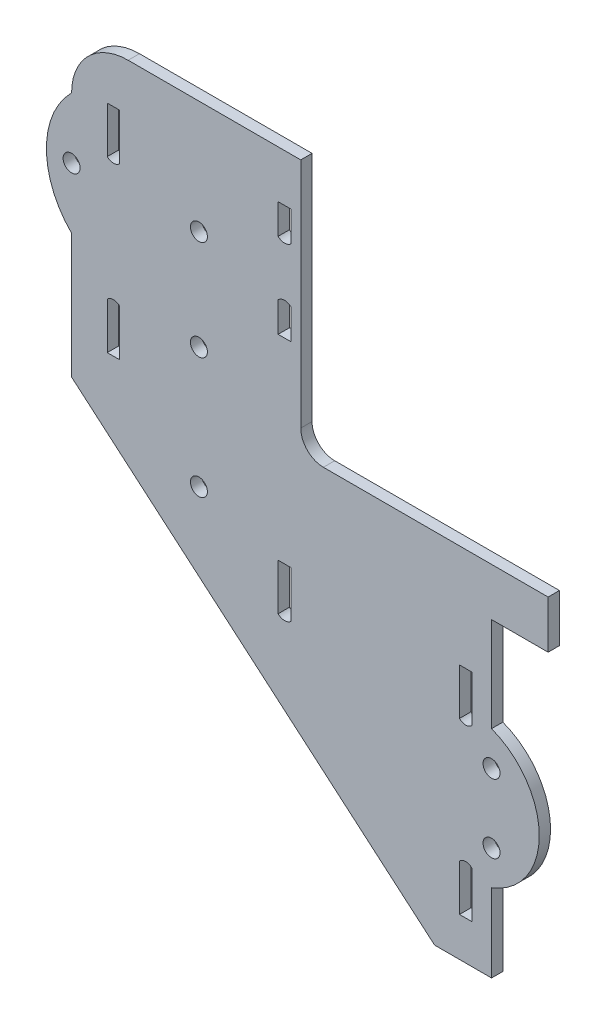
from build123d import *

# Parameters (mm, degrees)
SKETCH_1_R      = 1.5
EXTRUDE_1_DEPTH = 2


with BuildPart() as part:
    # 草图1 → 凸台-拉伸1 (new body)
    with BuildSketch(Plane.XY):
        with BuildLine():
            Line((24.667061038, -23.701524127), (24.667061038, 17.348475873))
            Line((24.667061038, 17.348475873), (-5.837728854, 17.348475873))
            ThreePointArc((-5.837728854, 17.348475873), (-12.908796666, 14.419543685), (-15.837728854, 7.348475873))
            ThreePointArc((-15.837728854, 7.348475873), (-20.286537867, -3.391899182), (-15.837728854, -14.132274238))
            Line((-15.837728854, -14.132274238), (-15.837728854, -36.151614729))
            Line((-15.837728854, -36.151614729), (48.322917805, -91.01542846))
            Line((48.322917805, -91.01542846), (58.385554114, -91.01542846))
            Line((58.385554114, -91.01542846), (58.385554114, -77.195903488))
            ThreePointArc((58.385554114, -77.195903488), (66.817061038, -65.025083014), (58.385554114, -52.85426254))
            Line((58.385554114, -52.85426254), (58.385554114, -41.837165292))
            Line((58.385554114, -41.837165292), (58.385554114, -36.151614729))
            Line((58.385554114, -36.151614729), (68.385554114, -36.151614729))
            Line((68.385554114, -36.151614729), (68.385554114, -27.701524127))
            Line((68.385554114, -27.701524127), (58.385554114, -27.701524127))
            Line((58.385554114, -27.701524127), (28.667061038, -27.701524127))
            ThreePointArc((28.667061038, -27.701524127), (25.838633913, -26.529951252), (24.667061038, -23.701524127))
        make_face()
        with Locations((6.667061038, -41.688027493)):
            Circle(SKETCH_1_R, mode=Mode.SUBTRACT)
        with BuildLine():
            Line((20.667061038, -54.125083014), (20.667061038, -45.925083014))
            Line((20.667061038, -45.925083014), (22.967061038, -45.925083014))
            Line((22.967061038, -45.925083014), (22.967061038, -54.125083014))
            ThreePointArc((22.967061038, -54.125083014), (21.817061038, -54.601428611), (20.667061038, -54.125083014))
        make_face(mode=Mode.SUBTRACT)
        with BuildLine():
            Line((52.717061038, -84.125083014), (52.717061038, -75.925083014))
            ThreePointArc((52.717061038, -75.925083014), (53.817061038, -75.469448095), (54.917061038, -75.925083014))
            Line((54.917061038, -75.925083014), (54.917061038, -84.125083014))
            Line((54.917061038, -84.125083014), (52.717061038, -84.125083014))
        make_face(mode=Mode.SUBTRACT)
        with Locations((58.385554114, -71.110493251)):
            Circle(SKETCH_1_R, mode=Mode.SUBTRACT)
        with Locations((58.385554114, -58.939672777)):
            Circle(SKETCH_1_R, mode=Mode.SUBTRACT)
        with BuildLine():
            Line((52.717061038, -54.125083014), (52.717061038, -45.925083014))
            Line((52.717061038, -45.925083014), (54.917061038, -45.925083014))
            Line((54.917061038, -45.925083014), (54.917061038, -54.125083014))
            ThreePointArc((54.917061038, -54.125083014), (53.817061038, -54.580717932), (52.717061038, -54.125083014))
        make_face(mode=Mode.SUBTRACT)
        with BuildLine():
            Line((-9.532938962, -29.250971973), (-9.532938962, -21.050971973))
            ThreePointArc((-9.532938962, -21.050971973), (-8.432938962, -20.595337054), (-7.332938962, -21.050971973))
            Line((-7.332938962, -21.050971973), (-7.332938962, -29.250971973))
            Line((-7.332938962, -29.250971973), (-9.532938962, -29.250971973))
        make_face(mode=Mode.SUBTRACT)
        with Locations((6.667061038, -20.300971973)):
            Circle(SKETCH_1_R, mode=Mode.SUBTRACT)
        with Locations((-15.837728854, -3.391899182)):
            Circle(SKETCH_1_R, mode=Mode.SUBTRACT)
        with BuildLine():
            Line((-9.532938962, 0.749028027), (-9.532938962, 8.949028027))
            Line((-9.532938962, 8.949028027), (-7.332938962, 8.949028027))
            Line((-7.332938962, 8.949028027), (-7.332938962, 0.749028027))
            ThreePointArc((-7.332938962, 0.749028027), (-8.432938962, 0.293393109), (-9.532938962, 0.749028027))
        make_face(mode=Mode.SUBTRACT)
        with Locations((6.667061038, -2.650971973)):
            Circle(SKETCH_1_R, mode=Mode.SUBTRACT)
        with BuildLine():
            Line((20.667061038, -11.350971973), (20.667061038, -6.050971973))
            ThreePointArc((20.667061038, -6.050971973), (21.817061038, -5.574626376), (22.967061038, -6.050971973))
            Line((22.967061038, -6.050971973), (22.967061038, -11.350971973))
            Line((22.967061038, -11.350971973), (20.667061038, -11.350971973))
        make_face(mode=Mode.SUBTRACT)
        with BuildLine():
            Line((20.667061038, 3.649028027), (20.667061038, 8.949028027))
            Line((20.667061038, 8.949028027), (22.967061038, 8.949028027))
            Line((22.967061038, 8.949028027), (22.967061038, 3.649028027))
            ThreePointArc((22.967061038, 3.649028027), (21.817061038, 3.172682431), (20.667061038, 3.649028027))
        make_face(mode=Mode.SUBTRACT)
    extrude(amount=EXTRUDE_1_DEPTH)


solid = part.part
